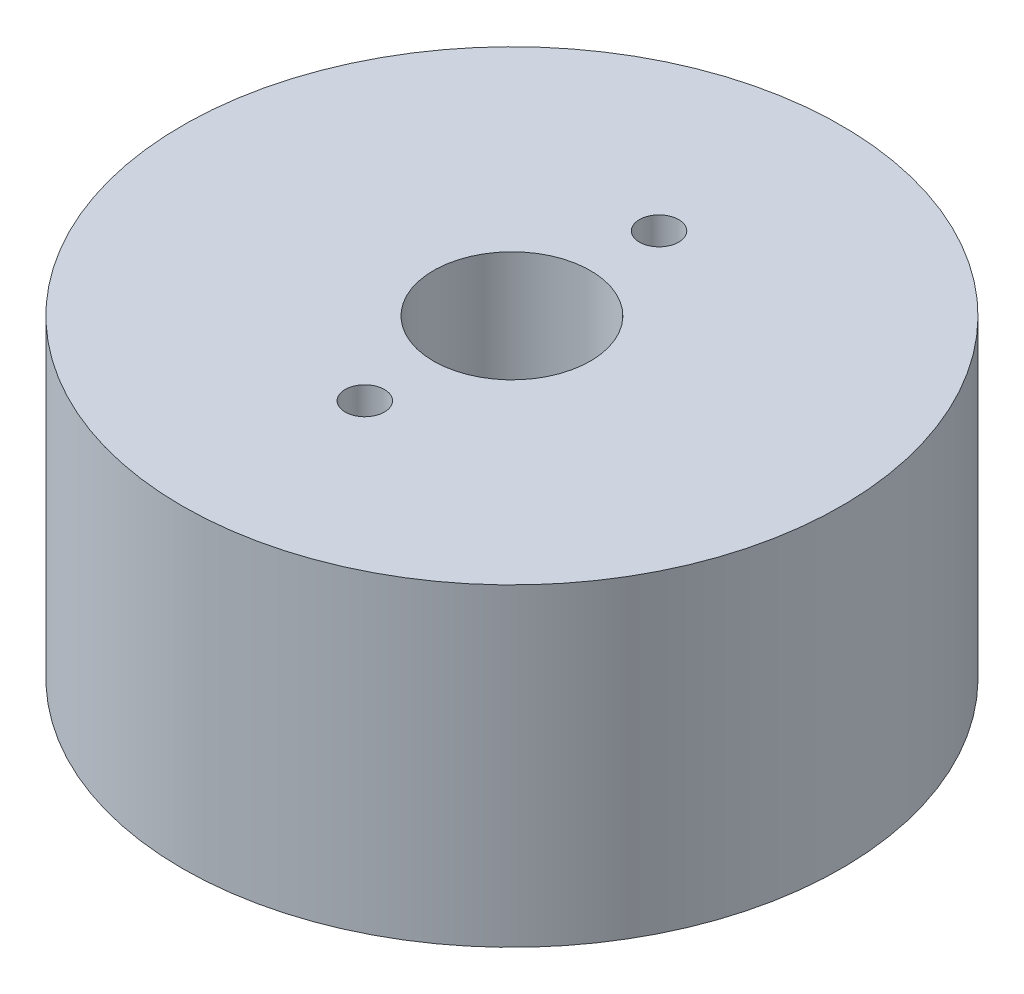
from build123d import *

# Parameters (mm, degrees)
SKETCH1_R           = 16.8
BOSS_EXTRUDE1_DEPTH = 16
SKETCH2_R           = 4
CUT_EXTRUDE1_DEPTH  = 29.644022064
SKETCH3_R           = 1
CUT_EXTRUDE2_DEPTH  = 5
SKETCH4_R           = 1.5
CUT_EXTRUDE3_DEPTH  = 5


with BuildPart() as part:
    # Sketch1 → Boss-Extrude1 (new body)
    with BuildSketch(Plane(origin=(0, 0, 0), x_dir=(1, 0, 0), z_dir=(0, 1, 0))):
        with Locations(Location((0, 0, 0), (0, 0, 270))):
            Circle(SKETCH1_R)
    extrude(amount=BOSS_EXTRUDE1_DEPTH)

    # Sketch2 → Cut-Extrude1 (cut, through all)
    with BuildSketch(Plane(origin=(0, 16, 0), x_dir=(1, 0, 0), z_dir=(0, 1, 0))):
        with Locations(Location((0, 0, 0), (0, 0, 270))):
            Circle(SKETCH2_R)
    extrude(amount=-CUT_EXTRUDE1_DEPTH, mode=Mode.SUBTRACT)

    # Sketch3 → Cut-Extrude2 (cut)
    with BuildSketch(Plane(origin=(0, 16, 0), x_dir=(1, 0, 0), z_dir=(0, 1, 0))):
        with Locations(Location((0, 7.5, 0), (0, 0, 270))):
            Circle(SKETCH3_R)
        with Locations(Location((0, -7.5, 0), (0, 0, 270))):
            Circle(SKETCH3_R)
    extrude(amount=-CUT_EXTRUDE2_DEPTH, mode=Mode.SUBTRACT)

    # Sketch4 → Cut-Extrude3 (cut)
    with BuildSketch(Plane.XZ):
        with Locations(Location((0, 11.25, 0), (0, 0, 270))):
            Circle(SKETCH4_R)
        with Locations(Location((11.25, 0, 0), (0, 0, 270))):
            Circle(SKETCH4_R)
        with Locations(Location((0, -11.25, 0), (0, 0, 270))):
            Circle(SKETCH4_R)
        with Locations(Location((-11.25, 0, 0), (0, 0, 270))):
            Circle(SKETCH4_R)
    extrude(amount=-CUT_EXTRUDE3_DEPTH, mode=Mode.SUBTRACT)


solid = part.part
